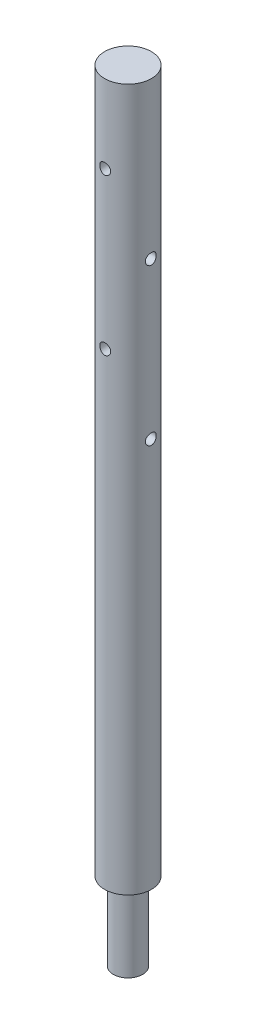
from build123d import *

# Parameters (mm, degrees)
SKETCH1_R             = 3.81
BOSS_EXTRUDE1_DEPTH   = 127
F_2_64_TAPPED_HOLE1_D = 1.778
F_2_64_TAPPED_HOLE2_D = 1.778
LPATTERN1_COUNT       = 2
LPATTERN1_PITCH       = 25.4
LPATTERN2_COUNT       = 2
LPATTERN2_PITCH       = 25.4
SKETCH22_R            = 3.81
SKETCH22_R_2          = 2.38125
CUT_EXTRUDE1_DEPTH    = 12.7


with BuildPart() as part:
    # Sketch1 → Boss-Extrude1 (new body)
    with BuildSketch(Plane(origin=(0, 0, 0), x_dir=(1, 0, 0), z_dir=(0, 1, 0))):
        with Locations(Location((0, 0, 0), (0, 0, 270))):
            Circle(SKETCH1_R)
    extrude(amount=BOSS_EXTRUDE1_DEPTH)

    # #2-64 Tapped Hole1 (through all)
    with Locations(Plane(origin=(3.81, 0, 0), x_dir=(0, 0, -1), z_dir=(1, 0, 0))):
        with Locations((0, 76.2)):
            f_2_64_tapped_hole1 = Hole(F_2_64_TAPPED_HOLE1_D / 2)

    # #2-64 Tapped Hole2 (through all)
    with Locations(Plane(origin=(0, 0, 3.81), x_dir=(0, -1, 0), z_dir=(0, 0, 1))):
        with Locations((-88.9, 0)):
            f_2_64_tapped_hole2 = Hole(F_2_64_TAPPED_HOLE2_D / 2)

    # LPattern1: #2-64 Tapped Hole1 ×2
    with Locations(*[(0, i * LPATTERN1_PITCH, 0) for i in range(1, LPATTERN1_COUNT)]):
        add(f_2_64_tapped_hole1, mode=Mode.SUBTRACT)

    # LPattern2: #2-64 Tapped Hole2 ×2
    with Locations(*[(0, i * LPATTERN2_PITCH, 0) for i in range(1, LPATTERN2_COUNT)]):
        add(f_2_64_tapped_hole2, mode=Mode.SUBTRACT)

    # Sketch22 → Cut-Extrude1 (cut)
    with BuildSketch(Plane.XZ):
        with Locations(Location((0, 0, 0), (0, 0, 270))):
            Circle(SKETCH22_R)
        with Locations(Location((0, 0, 0), (0, 0, 270))):
            Circle(SKETCH22_R_2, mode=Mode.SUBTRACT)
    extrude(amount=-CUT_EXTRUDE1_DEPTH, mode=Mode.SUBTRACT)


solid = part.part
